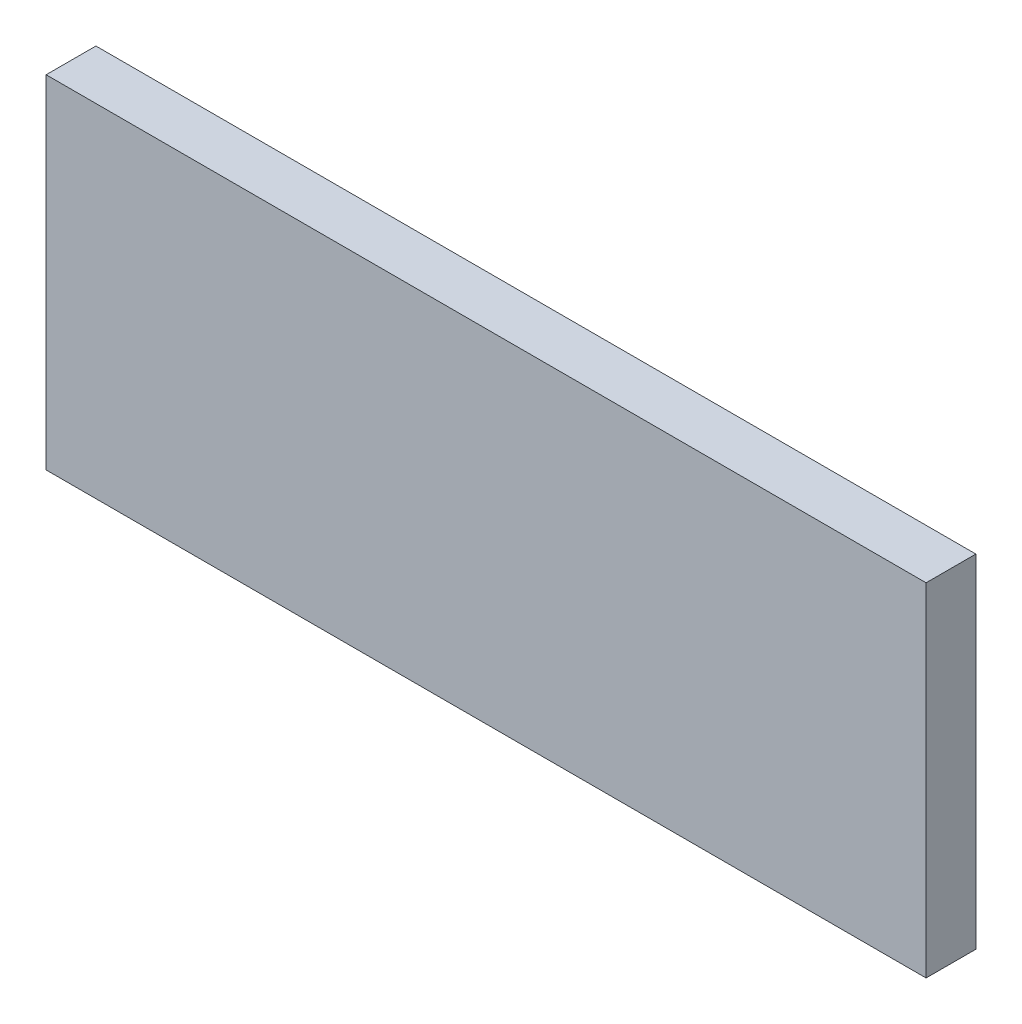
from build123d import *

# Parameters (mm, degrees)
SKETCH_1_W      = 14.14
SKETCH_1_H      = 5.5
EXTRUDE_1_DEPTH = 0.8


with BuildPart() as part:
    # 草图1 → 凸台-拉伸1 (new body)
    with BuildSketch(Plane.XY):
        with Locations((7.07, -2.75)):
            Rectangle(SKETCH_1_W, SKETCH_1_H)
    extrude(amount=EXTRUDE_1_DEPTH)


solid = part.part
